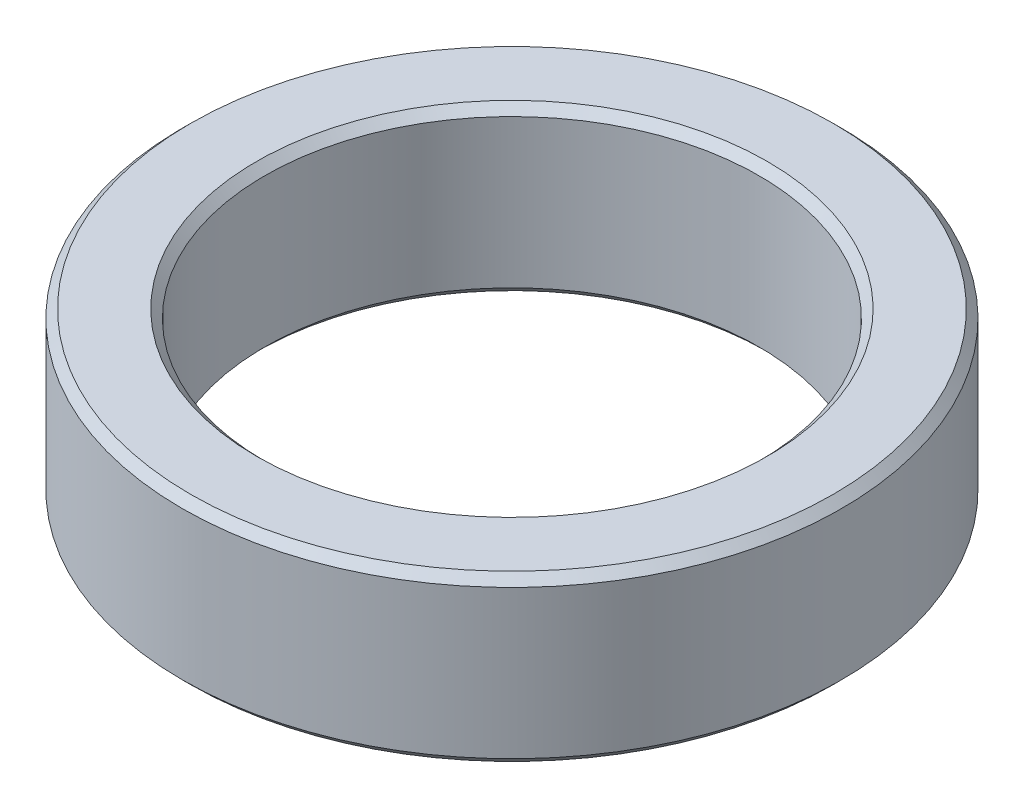
from build123d import *

# Parameters (mm, degrees)
SKETCH1_R           = 20
SKETCH1_R_2         = 15
BOSS_EXTRUDE1_DEPTH = 5
CHAMFER1_SIZE       = 0.5


with BuildPart() as part:
    # Sketch1 → Boss-Extrude1 (new, symmetric)
    with BuildSketch(Plane(origin=(0, 0, 0), x_dir=(1, 0, 0), z_dir=(0, 1, 0))):
        with Locations(Location((0, 0, 0), (0, 0, 270))):
            Circle(SKETCH1_R)
        with Locations(Location((0, 0, 0), (0, 0, 270))):
            Circle(SKETCH1_R_2, mode=Mode.SUBTRACT)
    extrude(amount=BOSS_EXTRUDE1_DEPTH, both=True)

    # Chamfer1
    chamfer1_edges = [part.edges().sort_by_distance(p)[0] for p in [
        (0, -5, -20),
        (0, 5, -20),
        (0, -5, -15),
        (0, 5, -15),
    ]]
    chamfer(chamfer1_edges, length=CHAMFER1_SIZE)


solid = part.part
